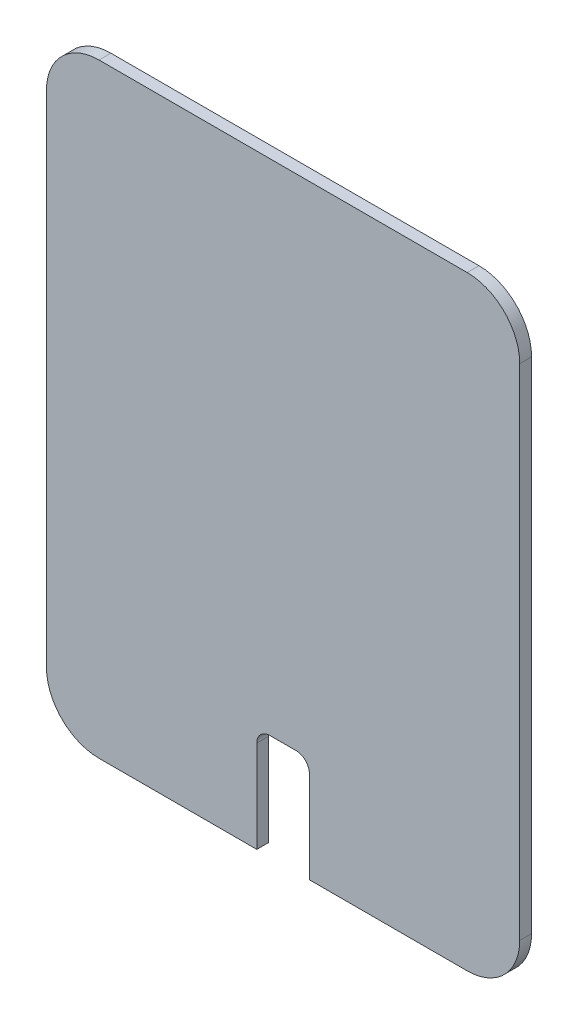
from build123d import *

# Parameters (mm, degrees)
EXTRUDE_1_DEPTH     = 4.5
CUT_EXTRUDE_1_DEPTH = 4.5


with BuildPart() as part:
    # 草图1 → 凸台-拉伸1 (new body)
    with BuildSketch(Plane.XY):
        with BuildLine():
            Line((-70, -115), (70, -115))
            ThreePointArc((70, -115), (84.142135624, -109.142135624), (90, -95))
            Line((90, -95), (90, 95))
            ThreePointArc((90, 95), (84.142135624, 109.142135624), (70, 115))
            Line((70, 115), (-70, 115))
            ThreePointArc((-70, 115), (-84.142135624, 109.142135624), (-90, 95))
            Line((-90, 95), (-90, -95))
            ThreePointArc((-90, -95), (-84.142135624, -109.142135624), (-70, -115))
        make_face()
    extrude(amount=EXTRUDE_1_DEPTH)

    # 草图2 → 切除-拉伸1 (cut)
    with BuildSketch(Plane.XY.offset(4.5)):
        with BuildLine():
            Line((-10, -155), (10, -155))
            Line((10, -155), (10, -80))
            ThreePointArc((10, -80), (8.535533906, -76.464466094), (5, -75))
            Line((5, -75), (-5, -75))
            ThreePointArc((-5, -75), (-8.535533906, -76.464466094), (-10, -80))
            Line((-10, -80), (-10, -155))
        make_face()
    extrude(amount=-CUT_EXTRUDE_1_DEPTH, mode=Mode.SUBTRACT)


solid = part.part
